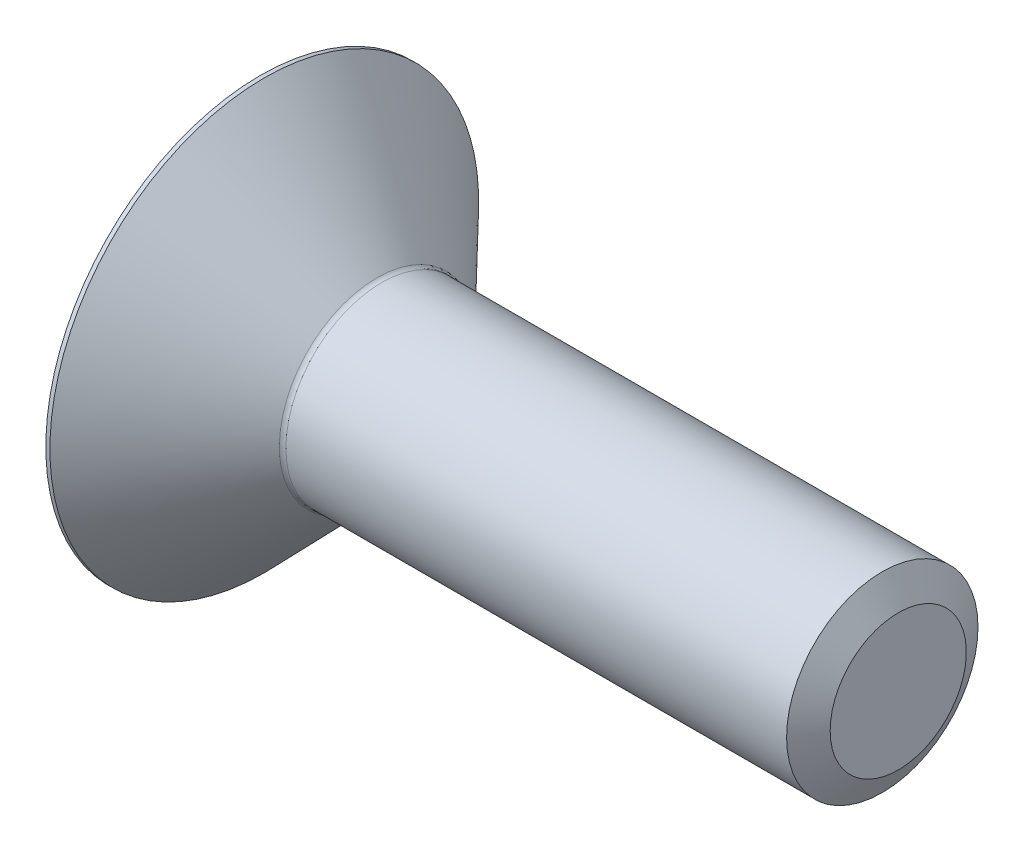
from build123d import *

# Parameters (mm, degrees)
CUT_EXTRUDE_1_DEPTH = 1.86


with BuildPart() as part:
    # 草图1 → 旋转1 (revolve)
    with BuildSketch(Plane.XY):
        with BuildLine():
            Line((0, 1.5), (-8.097552518, 1.5))
            ThreePointArc((-8.097552518, 1.5), (-8.136625631, 1.507949515), (-8.169486498, 1.530534163))
            Line((-8.169486498, 1.530534163), (-9.936181121, 3.36))
            Line((-9.936181121, 3.36), (-10, 3.36))
            Line((-10, 3.36), (-10, 0))
            Line((-10, 0), (0, 0))
            Line((0, 0), (0, 1.5))
        make_face()
    revolve(axis=Axis((0, 0, 0), (-1, 0, 0)))

    # 草图2 → 切除-拉伸1 (cut)
    with BuildSketch(Plane.ZY.offset(10)):
        Polygon((0, 1.154700538), (-1, 0.577350269), (-1, -0.577350269), (0, -1.154700538), (1, -0.577350269), (1, 0.577350269), align=None)
    extrude(amount=-CUT_EXTRUDE_1_DEPTH, mode=Mode.SUBTRACT)

    # 草图6 → 旋转2 (revolve)
    with BuildSketch(Plane.XY):
        Polygon((-8.9, 1.154700538), (-8.233333333, 0), (-7.84, 0), (-7.84, 1.154700538), align=None)
    revolve(axis=Axis((-10, 0, 0), (1, 0, 0)))

    # 草图7 → 切除-旋转2 (revolve, cut)
    with BuildSketch(Plane.XY):
        Polygon((-10, 1.154700538), (-10, 0), (-9.7, 0), align=None)
    revolve(axis=Axis((-10, 0, 0), (1, 0, 0)), mode=Mode.SUBTRACT)

    # 草图4 → 切除-旋转1 (revolve, cut)
    with BuildSketch(Plane.XY):
        Polygon((-0.25, 1.5), (0, 1.066987298), (0.25, 1.5), align=None)
    revolve(axis=Axis((-0.25, 0, 0), (1, 0, 0)), mode=Mode.SUBTRACT)


solid = part.part
